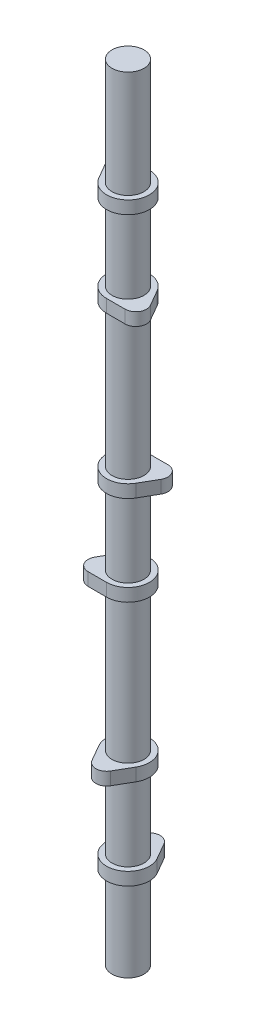
from build123d import *

# Parameters (mm, degrees)
BOSS_EXTRUDE2_DEPTH   = 3.81
LPATTERN4_COUNT       = 2
LPATTERN4_PITCH       = 53.34
BODY_MOVE_COPY5_ANGLE = 180
LPATTERN5_COUNT       = 3
LPATTERN5_PITCH       = 146.05
BODY_MOVE_COPY6_ANGLE = 120
BODY_MOVE_COPY7_ANGLE = 120
BOSS_EXTRUDE3_START   = -53.34
SKETCH5_R             = 9.5
BOSS_EXTRUDE3_DEPTH   = 466.09


with BuildPart() as part:
    # Sketch4 → Boss-Extrude2 (new, symmetric)
    with BuildSketch(Plane(origin=(0, 0, 0), x_dir=(1, 0, 0), z_dir=(0, 1, 0))):
        with BuildLine():
            Line((5.499261314, 15.875), (10.998522628, 6.35))
            ThreePointArc((10.998522628, 6.35), (0, -12.7), (-10.998522628, 6.35))
            Line((-10.998522628, 6.35), (-5.499261314, 15.875))
            ThreePointArc((-5.499261314, 15.875), (0, 19.05), (5.499261314, 15.875))
        make_face()
    extrude(amount=BOSS_EXTRUDE2_DEPTH, both=True)


with BuildPart() as lpattern4_1:
    # LPattern4: pattern copy
    add(part.part.moved(Location(Vector(0, 1, 0) * (1 * LPATTERN4_PITCH))))


with BuildPart() as lpattern4_1_1:
    # Body-Move/Copy5: moved
    add(lpattern4_1.part.rotate(Axis((0, 0, 0), (0, 1, 0)), BODY_MOVE_COPY5_ANGLE))


with BuildPart() as lpattern5_1:
    # LPattern5: pattern copy
    add(part.part.moved(Location(Vector(0, 1, 0) * (1 * LPATTERN5_PITCH))))


with BuildPart() as lpattern5_2:
    # LPattern5: pattern copy
    add(part.part.moved(Location(Vector(0, 1, 0) * (2 * LPATTERN5_PITCH))))


with BuildPart() as lpattern5_3:
    # LPattern5: pattern copy
    add(lpattern4_1_1.part.moved(Location(Vector(0, 1, 0) * (1 * LPATTERN5_PITCH))))


with BuildPart() as lpattern5_4:
    # LPattern5: pattern copy
    add(lpattern4_1_1.part.moved(Location(Vector(0, 1, 0) * (2 * LPATTERN5_PITCH))))


with BuildPart() as lpattern5_1_1:
    # Body-Move/Copy6: moved
    add(lpattern5_1.part.rotate(Axis((0, 0, 0), (0, 1, 0)), BODY_MOVE_COPY6_ANGLE))


with BuildPart() as lpattern5_3_1:
    # Body-Move/Copy6: moved
    add(lpattern5_3.part.rotate(Axis((0, 0, 0), (0, 1, 0)), BODY_MOVE_COPY6_ANGLE))


with BuildPart() as lpattern5_2_1:
    # Body-Move/Copy7: moved
    add(lpattern5_2.part.rotate(Axis((0, 0, 0), (0, -1, 0)), BODY_MOVE_COPY7_ANGLE))


with BuildPart() as lpattern5_4_1:
    # Body-Move/Copy7: moved
    add(lpattern5_4.part.rotate(Axis((0, 0, 0), (0, -1, 0)), BODY_MOVE_COPY7_ANGLE))


with BuildPart() as part_1:
    add(part.part)

    add(lpattern4_1_1.part)  # Boss-Extrude3 merges LPattern4_1

    add(lpattern5_1_1.part)  # Boss-Extrude3 merges LPattern5_1

    add(lpattern5_2_1.part)  # Boss-Extrude3 merges LPattern5_2

    add(lpattern5_3_1.part)  # Boss-Extrude3 merges LPattern5_3

    add(lpattern5_4_1.part)  # Boss-Extrude3 merges LPattern5_4
    # Sketch5 → Boss-Extrude3 (add)
    with BuildSketch(Plane(origin=(0, 0, 0), x_dir=(1, 0, 0), z_dir=(0, 1, 0)).offset(BOSS_EXTRUDE3_START)):
        Circle(SKETCH5_R)
    extrude(amount=BOSS_EXTRUDE3_DEPTH)


solid = part_1.part
